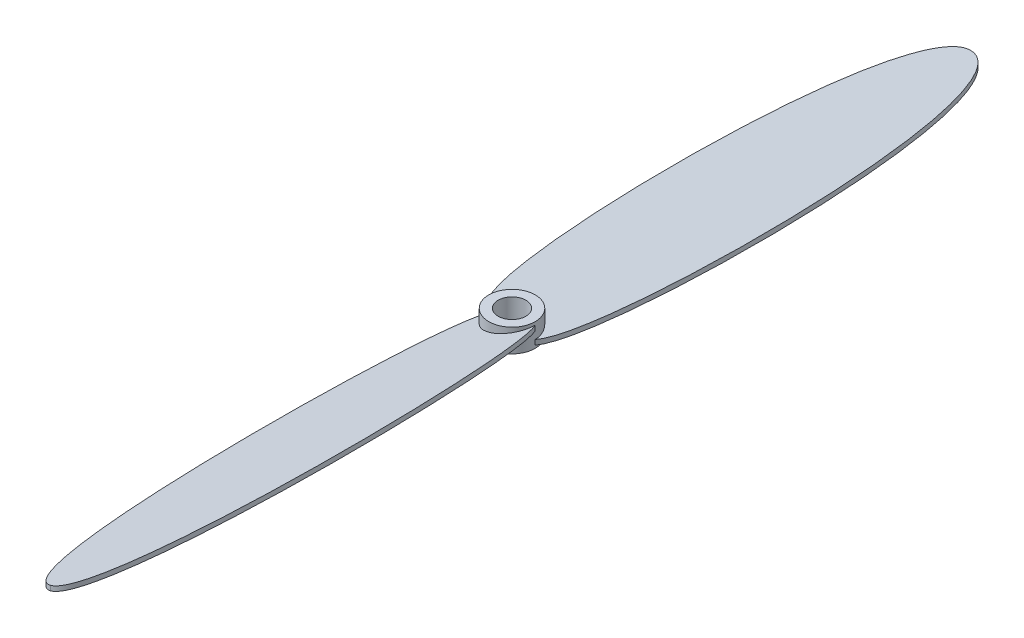
from build123d import *

# Parameters (mm, degrees)
SKETCH_1_R               = 5
SKETCH_1_R_2             = 3
EXTRUDE_1_DEPTH          = 5
EXTRUDE_7_DEPTH          = 100
EXTRUDE_8_DEPTH          = 100
SKETCH_8_R               = 3
CUT_EXTRUDE_1_DEPTH      = 101.669947854
CUT_EXTRUDE_2_DEPTH      = 101.669947854
CUT_EXTRUDE_2_DEPTH_BACK = 101.669947854
SKETCH_9_OUTSIDE_W       = 62.542
SKETCH_9_OUTSIDE_H       = 242.224


with BuildPart() as part:
    # 草圖1 → 填料-伸長1 (new body)
    with BuildSketch(Plane(origin=(0, 0, 0), x_dir=(1, 0, 0), z_dir=(0, 1, 0))):
        with Locations(Location((0, 0, 0), (0, 0, 270))):
            Circle(SKETCH_1_R)
        with Locations(Location((0, 0, 0), (0, 0, 270))):
            Circle(SKETCH_1_R_2, mode=Mode.SUBTRACT)
    extrude(amount=EXTRUDE_1_DEPTH)

    # 草圖6 → 填料-伸長7 (add)
    with BuildSketch(Plane.XY):
        with BuildLine():
            Line((9.52984874, -0.571153364), (-9.788667785, 4.605227538))
            ThreePointArc((-9.788667785, 4.605227538), (-10.142221176, 5.217599974), (-9.52984874, 5.571153364))
            Line((-9.52984874, 5.571153364), (9.788667785, 0.394772462))
            ThreePointArc((9.788667785, 0.394772462), (10.142221176, -0.217599974), (9.52984874, -0.571153364))
        make_face()
    extrude(amount=-EXTRUDE_7_DEPTH)

    # 草圖7 → 填料-伸長8 (add)
    with BuildSketch(Plane.XY):
        with BuildLine():
            Line((-9.788667785, 0.394772462), (9.52984874, 5.571153364))
            ThreePointArc((9.52984874, 5.571153364), (10.142221176, 5.217599974), (9.788667785, 4.605227538))
            Line((9.788667785, 4.605227538), (-9.52984874, -0.571153364))
            ThreePointArc((-9.52984874, -0.571153364), (-10.142221176, -0.217599974), (-9.788667785, 0.394772462))
        make_face()
    extrude(amount=EXTRUDE_8_DEPTH)

    # 草圖8 → 除料-伸長1 (cut, through all)
    with BuildSketch(Plane(origin=(0, 5, 0), x_dir=(1, 0, 0), z_dir=(0, 1, 0))):
        with Locations(Location((0, 0, 0), (0, 0, 270))):
            Circle(SKETCH_8_R)
    extrude(amount=-CUT_EXTRUDE_1_DEPTH, mode=Mode.SUBTRACT)

    # 草圖9 outside → 除料-伸長2 (cut, two sides: drawn at the far end of the back side and taken through both)
    with BuildSketch(Plane(origin=(0, 5, 0), x_dir=(1, 0, 0), z_dir=(0, 1, 0)).offset(-CUT_EXTRUDE_2_DEPTH_BACK)):
        Rectangle(SKETCH_9_OUTSIDE_W, SKETCH_9_OUTSIDE_H)
        with BuildLine():
            add(Edge.make_bspline(
                [(5, 0), (10.515647221, 9.319471188), (11.320981167, 99.5), (0, 99.5)],
                knots=[0, 0, 0, 0, 1, 1, 1, 1], degree=3))
            add(Edge.make_bspline(
                [(-5, 0), (-10.515647221, 9.319471188), (-11.320981167, 99.5), (0, 99.5)],
                knots=[0, 0, 0, 0, 1, 1, 1, 1], degree=3))
            add(Edge.make_bspline(
                [(-5, 0), (-10.515647221, -9.319471188), (-11.320981167, -99.5), (0, -99.5)],
                knots=[0, 0, 0, 0, 1, 1, 1, 1], degree=3))
            add(Edge.make_bspline(
                [(5, 0), (10.515647221, -9.319471188), (11.320981167, -99.5), (0, -99.5)],
                knots=[0, 0, 0, 0, 1, 1, 1, 1], degree=3))
        make_face(mode=Mode.SUBTRACT)
    extrude(amount=CUT_EXTRUDE_2_DEPTH + CUT_EXTRUDE_2_DEPTH_BACK, mode=Mode.SUBTRACT)


solid = part.part
